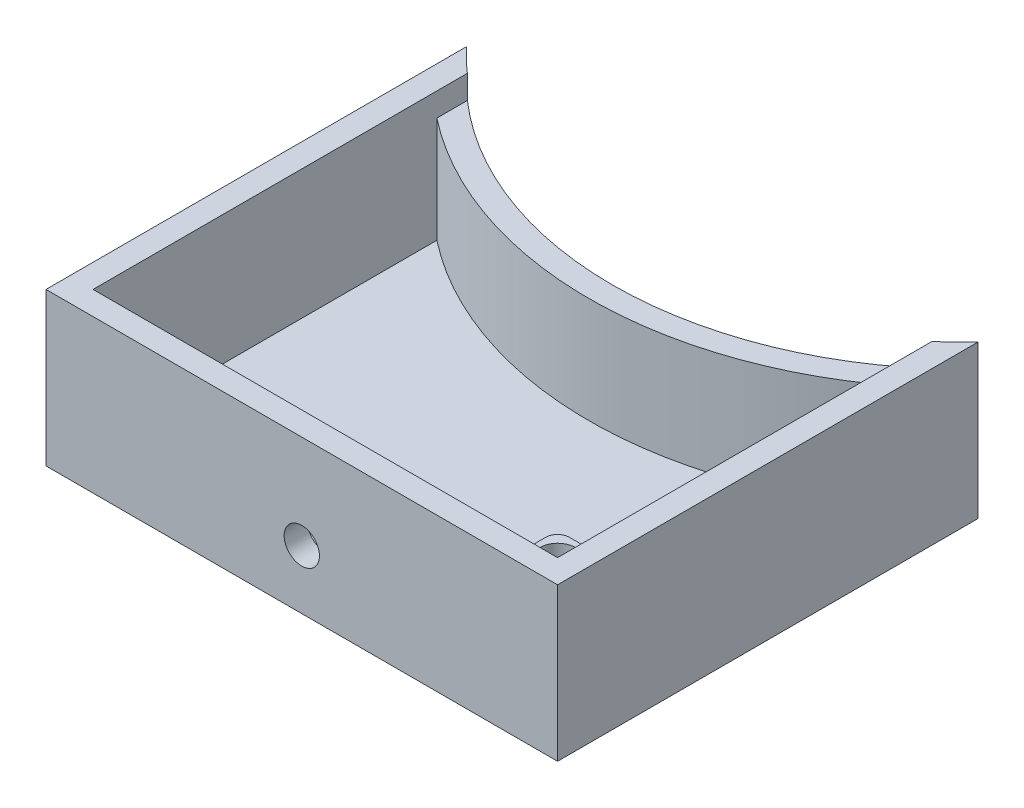
from build123d import *

# Parameters (mm, degrees)
BOSS_EXTRUDE1_DEPTH = 13
SHELL1_T            = -2
CUT_EXTRUDE1_START  = -2
CUT_EXTRUDE1_DEPTH  = 2
CUT_EXTRUDE2_REACH  = 45.819
SKETCH3_R           = 1.5
SKETCH4_W           = 4
SKETCH4_H           = 4
SKETCH4_R           = 1.5
BOSS_EXTRUDE2_DEPTH = 9
FILLET1_R           = 1


with BuildPart() as part:
    # Sketch1 → Boss-Extrude1 (new body)
    with BuildSketch(Plane(origin=(0, 0, 0), x_dir=(1, 0, 0), z_dir=(0, 1, 0))):
        with BuildLine():
            ThreePointArc((21.75, 17.875), (0, 8.537465971), (-21.75, 17.875))
            Line((-21.75, 17.875), (-21.75, -17.875))
            Line((-21.75, -17.875), (21.75, -17.875))
            Line((21.75, -17.875), (21.75, 17.875))
        make_face()
    extrude(amount=BOSS_EXTRUDE1_DEPTH)

    # Shell1
    shell1_openings = [part.faces().sort_by_distance(p)[0] for p in [
        (0, 13, 3.099956695),
    ]]
    offset(amount=SHELL1_T, openings=shell1_openings, kind=Kind.INTERSECTION)

    # Sketch2 → Cut-Extrude1 (cut)
    with BuildSketch(Plane(origin=(0, 13, 0), x_dir=(1, 0, 0), z_dir=(0, 1, 0)).offset(CUT_EXTRUDE1_START)):
        with BuildLine():
            ThreePointArc((19.75, 15.955670205), (0, 8.537465971), (-19.75, 15.955670205))
            Line((-19.75, 15.955670205), (-19.75, 13.359350474))
            ThreePointArc((-19.75, 13.359350474), (0, 6.537465971), (19.75, 13.359350474))
            Line((19.75, 13.359350474), (19.75, 15.955670205))
        make_face()
    extrude(amount=CUT_EXTRUDE1_DEPTH, mode=Mode.SUBTRACT)

    # Sketch3 → Cut-Extrude2 (cut, up to next)
    with BuildSketch(Plane.XY.offset(17.875), mode=Mode.PRIVATE) as cut_extrude2_sk1:
        with Locations((0, 5)):
            Circle(SKETCH3_R)
    cut_extrude2_tool1 = extrude(cut_extrude2_sk1.sketch, amount=-CUT_EXTRUDE2_REACH, mode=Mode.PRIVATE) & part.part
    add(cut_extrude2_tool1.solids().sort_by_distance((0, 5, 17.875))[0], mode=Mode.SUBTRACT)

    # Sketch4 → Boss-Extrude2 (add)
    with BuildSketch(Plane(origin=(0, 2, 0), x_dir=(1, 0, 0), z_dir=(0, 1, 0))):
        with Locations((17.75, -13.875)):
            Rectangle(SKETCH4_W, SKETCH4_H)
        with Locations(Location((17.75, -13.875, 0), (0, 0, 270))):
            Circle(SKETCH4_R, mode=Mode.SUBTRACT)
    extrude(amount=BOSS_EXTRUDE2_DEPTH)

    # Fillet1
    fillet1_edges = [part.edges().sort_by_distance(p)[0] for p in [
        (15.75, 6.5, 11.875),
    ]]
    fillet(fillet1_edges, radius=FILLET1_R)


solid = part.part
